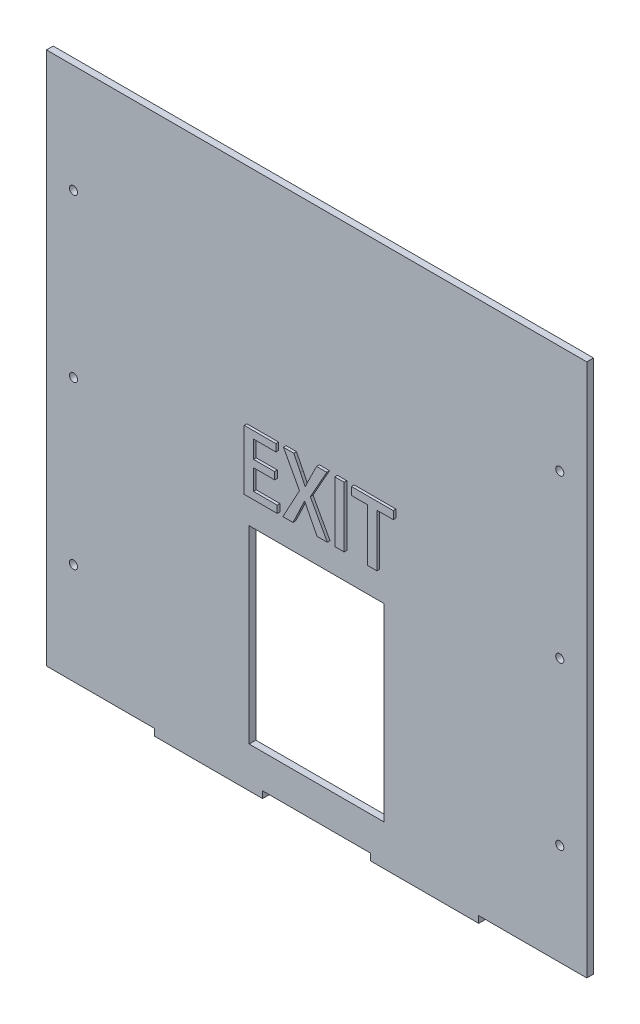
from build123d import *

# Parameters (mm, degrees)
SKETCH1_R           = 1.5
SKETCH1_W           = 50
SKETCH1_H           = 70
BOSS_EXTRUDE1_DEPTH = 2.5
SKETCH2_W           = 3.429676715
SKETCH2_H           = 22.352
BOSS_EXTRUDE2_DEPTH = 1


with BuildPart() as part:
    # Sketch1 → Boss-Extrude1 (new body)
    with BuildSketch(Plane.XY):
        Polygon((100, 100), (-100, 100), (-100, -97.5), (-60, -97.5), (-60, -100), (-20, -100), (-20, -97.5), (20, -97.5), (20, -100), (60, -100), (60, -97.5), (100, -97.5), align=None)
        with Locations((-90, -60)):
            Circle(SKETCH1_R, mode=Mode.SUBTRACT)
        with Locations((-90, 0)):
            Circle(SKETCH1_R, mode=Mode.SUBTRACT)
        with Locations((0, -50)):
            Rectangle(SKETCH1_W, SKETCH1_H, mode=Mode.SUBTRACT)
        with Locations((90, -60)):
            Circle(SKETCH1_R, mode=Mode.SUBTRACT)
        with Locations((90, 0)):
            Circle(SKETCH1_R, mode=Mode.SUBTRACT)
        with Locations((-90, 60)):
            Circle(SKETCH1_R, mode=Mode.SUBTRACT)
        with Locations((90, 60)):
            Circle(SKETCH1_R, mode=Mode.SUBTRACT)
    extrude(amount=BOSS_EXTRUDE1_DEPTH)

    # Sketch2 → Boss-Extrude2 (add)
    with BuildSketch(Plane.XY.offset(2.5)):
        Polygon((-13.574972078, -2.206402508), (-22.362641896, -2.206402508), (-22.362641896, 5.396315859), (-14.538404318, 5.396315859), (-14.538404318, 8.0657162), (-22.362641896, 8.0657162), (-22.362641896, 14.587158479), (-14.071285656, 14.587158479), (-14.071285656, 17.256562946), (-25.792318612, 17.256562946), (-25.792318612, -4.875802849), (-13.574972078, -4.875802849), align=None)
        with BuildLine():
            Line((-1.32204553, 6.603648154), (4.762112339, 17.501539559))
            Line((4.762112339, 17.501539559), (0.995728896, 17.501539559))
            Line((0.995728896, 17.501539559), (-1.437934251, 12.6228991))
            add(Edge.make_bspline(
                [(-1.437934251, 12.6228991), (-1.596718144, 12.303861859), (-1.904219722, 11.686012946), (-2.342902996, 10.763464709), (-2.769861176, 9.837525479), (-3.03923337, 9.20683016), (-3.17843881, 8.880901126)],
                knots=[0, 0, 0, 0, 1.03599958, 2.006321307, 2.969712076, 4, 4, 4, 4], degree=3))
            Line((-3.17843881, 8.880901126), (-3.234209432, 8.882782007))
            add(Edge.make_bspline(
                [(-3.234209432, 8.882782007), (-3.377496248, 9.189095467), (-3.661154937, 9.795490923), (-4.089483987, 10.709635801), (-4.532333468, 11.641980958), (-4.843108785, 12.270176419), (-5.003092207, 12.593563942)],
                knots=[0, 0, 0, 0, 0.987131341, 1.954181056, 2.946836831, 4, 4, 4, 4], degree=3))
            Line((-5.003092207, 12.593563942), (-7.46414776, 17.501539559))
            Line((-7.46414776, 17.501539559), (-11.259503382, 17.501539559))
            Line((-11.259503382, 17.501539559), (-5.349178596, 6.51598916))
            Line((-5.349178596, 6.51598916), (-11.490752858, -4.850460441))
            Line((-11.490752858, -4.850460441), (-7.753869563, -4.850460441))
            Line((-7.753869563, -4.850460441), (-5.465067317, -0.087655081))
            add(Edge.make_bspline(
                [(-5.465067317, -0.087655081), (-5.364335932, 0.114078616), (-5.167684585, 0.507910222), (-4.884459094, 1.085166952), (-4.624500068, 1.634448669), (-4.297310404, 2.31859573), (-3.914960495, 3.148810565), (-3.634210423, 3.815857985), (-3.495218913, 4.146094507)],
                knots=[0, 0, 0, 0, 0.869006123, 1.696504258, 2.478000857, 3.2109747, 4.619231574, 6, 6, 6, 6], degree=3))
            Line((-3.495218913, 4.146094507), (-3.408042514, 4.149196312))
            add(Edge.make_bspline(
                [(-3.408042514, 4.149196312), (-3.255611823, 3.817980032), (-2.94839099, 3.150420628), (-2.536943481, 2.319070478), (-2.189297936, 1.63260853), (-1.901799923, 1.085781735), (-1.594451142, 0.505813053), (-1.376920295, 0.112098507), (-1.265086983, -0.090311414)],
                knots=[0, 0, 0, 0, 1.381153135, 2.783684921, 3.513572612, 4.296050064, 5.123993829, 6, 6, 6, 6], degree=3))
            Line((-1.265086983, -0.090311414), (1.169561978, -4.850460441))
            Line((1.169561978, -4.850460441), (4.964917601, -4.850460441))
            Line((4.964917601, -4.850460441), (-1.32204553, 6.603648154))
        make_face()
        with Locations((9.442078464, 6.325539559)):
            Rectangle(SKETCH2_W, SKETCH2_H)
        Polygon((29.36462049, 17.50216652), (13.877443327, 17.50216652), (13.877443327, 14.611869802), (19.891596092, 14.611869802), (19.891596092, -4.831944479), (23.321272808, -4.831944479), (23.321272808, 14.611869802), (29.36462049, 14.611869802), align=None)
    extrude(amount=BOSS_EXTRUDE2_DEPTH)


solid = part.part
